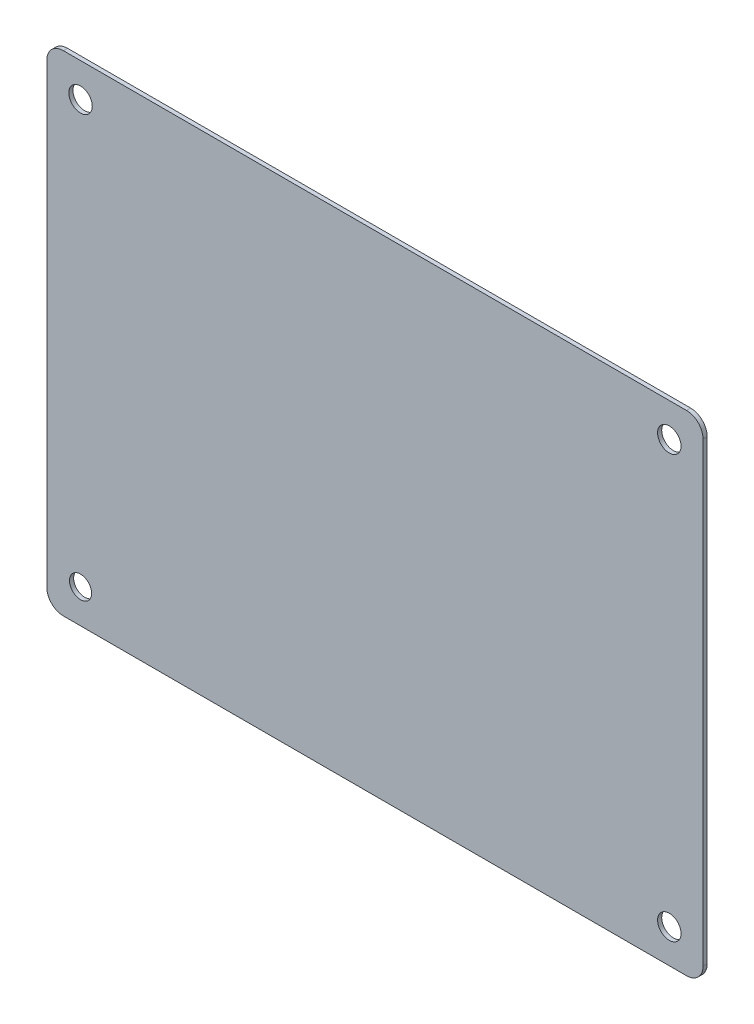
from build123d import *

# Parameters (mm, degrees)
SKETCH1_R           = 4.5
SKETCH1_R_2         = 4.25
BOSS_EXTRUDE1_DEPTH = 1.5875


with BuildPart() as part:
    # Sketch1 → Boss-Extrude1 (new body)
    with BuildSketch(Plane.XY):
        with BuildLine():
            Line((403.918477618, 1238.291553465), (643.139919853, 1238.291553465))
            ThreePointArc((643.139919853, 1238.291553465), (647.630047914, 1240.151425405), (649.489919853, 1244.641553465))
            Line((649.489919853, 1244.641553465), (649.489919853, 1419.8629957))
            ThreePointArc((649.489919853, 1419.8629957), (647.630047914, 1424.353123761), (643.139919853, 1426.2129957))
            Line((643.139919853, 1426.2129957), (403.918477618, 1426.2129957))
            ThreePointArc((403.918477618, 1426.2129957), (399.428349557, 1424.353123761), (397.568477618, 1419.8629957))
            Line((397.568477618, 1419.8629957), (397.568477618, 1244.641553465))
            ThreePointArc((397.568477618, 1244.641553465), (399.428349557, 1240.151425405), (403.918477618, 1238.291553465))
        make_face()
        with Locations((410.529198736, 1413.252274583)):
            Circle(SKETCH1_R, mode=Mode.SUBTRACT)
        with Locations((636.529198736, 1413.252274583)):
            Circle(SKETCH1_R, mode=Mode.SUBTRACT)
        with Locations((636.529198736, 1251.252274583)):
            Circle(SKETCH1_R, mode=Mode.SUBTRACT)
        with Locations((410.529198736, 1251.252274583)):
            Circle(SKETCH1_R_2, mode=Mode.SUBTRACT)
    extrude(amount=BOSS_EXTRUDE1_DEPTH)


solid = part.part
